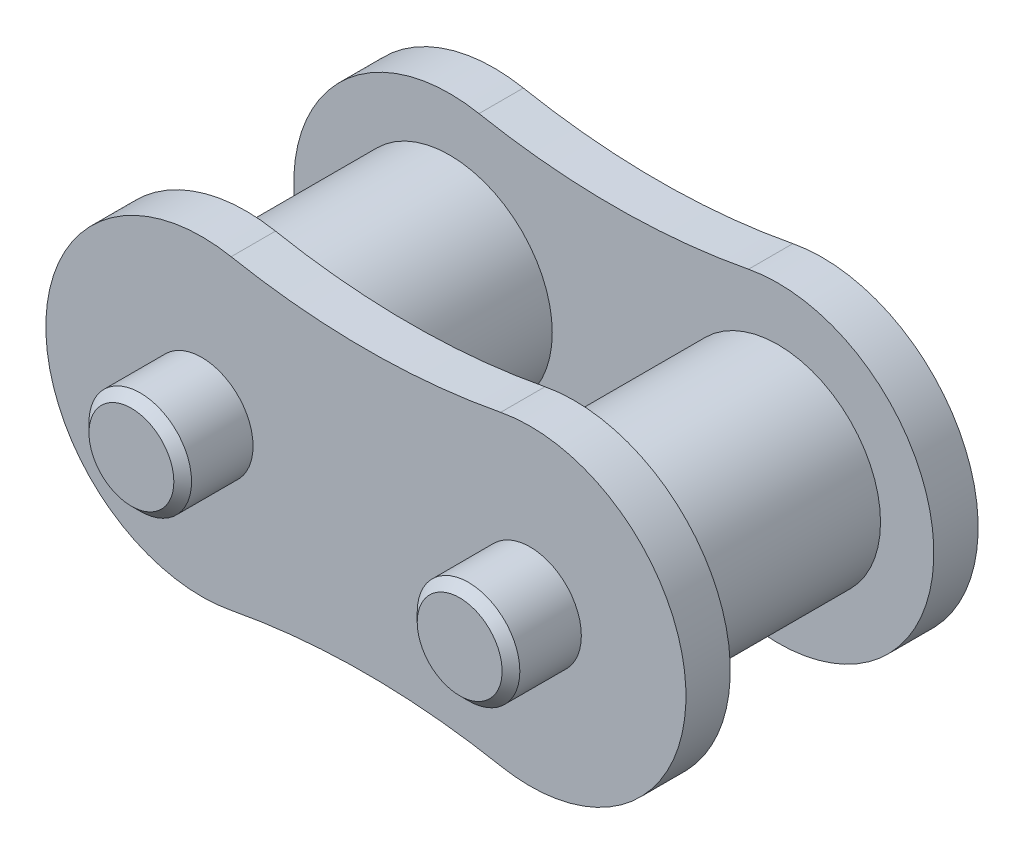
from build123d import *

# Parameters (mm, degrees)
SKETCH_2_R        = 7.94
EXTRUDE_1_DEPTH   = 7.875
EXTRUDE_1_2_DEPTH = 7.875
EXTRUDE_2_DEPTH   = 3.43
SKETCH_4_R        = 3.97
EXTRUDE_3_DEPTH   = 16.75
CHAMFER_1_SIZE    = 0.686


with BuildPart() as part:
    # 草图2 → 拉伸1 (new, symmetric)
    with BuildSketch(Plane.XY):
        with Locations((12.7, 0)):
            Circle(SKETCH_2_R)
    extrude(amount=EXTRUDE_1_DEPTH, both=True)



with BuildPart() as body_2:
    # 草图2 → Extrude 1 2 (new, symmetric)
    with BuildSketch(Plane.XY):
        with Locations((-12.7, 0)):
            Circle(SKETCH_2_R)
    extrude(amount=EXTRUDE_1_2_DEPTH, both=True)


with BuildPart() as part_1:
    add(part.part)

    add(body_2.part)  # 拉伸2 merges body 2
    # 草图3 → 拉伸2 (add)
    with BuildSketch(Plane.XY.offset(7.875)):
        with BuildLine():
            ThreePointArc((-10.428153415, 11.849174574), (-24.765, 0), (-10.428153415, -11.849174574))
            ThreePointArc((-10.428153415, -11.849174574), (0, -10.8585), (10.428153415, -11.849174574))
            ThreePointArc((10.428153415, -11.849174574), (24.765, 0), (10.428153415, 11.849174574))
            ThreePointArc((10.428153415, 11.849174574), (0, 10.8585), (-10.428153415, 11.849174574))
        make_face()
    extrude_2 = extrude(amount=EXTRUDE_2_DEPTH)

    # 镜向1: 拉伸2 across plane
    add(extrude_2.mirror(Plane.XY))

    # 草图4 → 拉伸3 (add, symmetric)
    with BuildSketch(Plane.XY):
        with Locations((12.7, 0)):
            Circle(SKETCH_4_R)
        with Locations((-12.7, 0)):
            Circle(SKETCH_4_R)
    extrude(amount=EXTRUDE_3_DEPTH, both=True)

    # 倒角1
    chamfer_1_edges = [part_1.edges().sort_by_distance(p)[0] for p in [
        (8.73, 0, -16.75),
        (8.73, 0, 16.75),
        (-16.67, 0, -16.75),
        (-16.67, 0, 16.75),
    ]]
    chamfer(chamfer_1_edges, length=CHAMFER_1_SIZE)


solid = part_1.part
